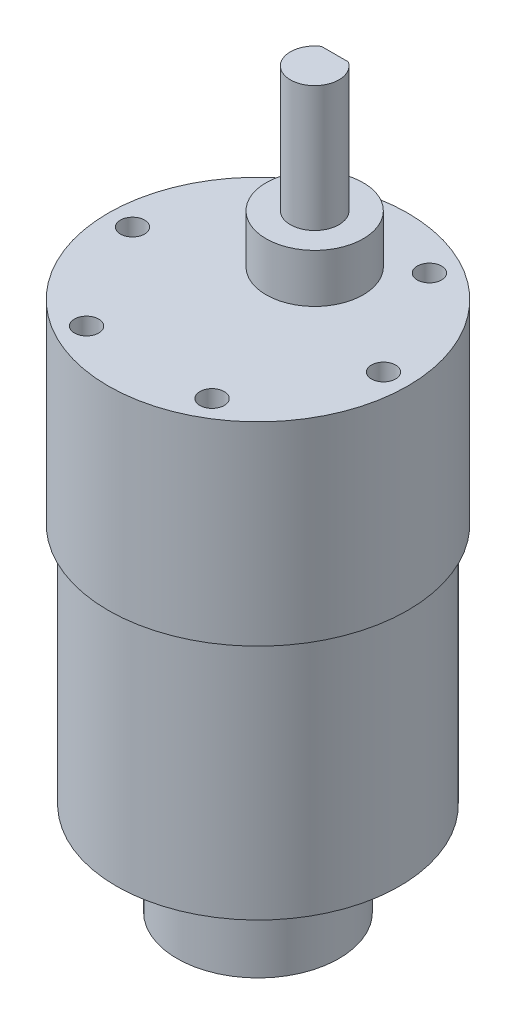
from build123d import *

# Parameters (mm, degrees)
SKETCH_1_R          = 18.5
EXTRUDE_1_DEPTH     = 24
SKETCH_2_R          = 6
EXTRUDE_2_DEPTH     = 6
SKETCH_3_R          = 3
EXTRUDE_3_DEPTH     = 15.5
SKETCH_4_R          = 17.5
EXTRUDE_4_DEPTH     = 30
SKETCH_5_R          = 10
EXTRUDE_6_DEPTH     = 11.5
CUT_EXTRUDE_1_DEPTH = 12
SKETCH_7_R          = 1.5
CUT_EXTRUDE_2_DEPTH = 10


with BuildPart() as part:
    # 草图1 → 凸台-拉伸1 (new body)
    with BuildSketch(Plane(origin=(0, 0, 0), x_dir=(1, 0, 0), z_dir=(0, 1, 0))):
        with Locations(Location((0, 0, 0), (0, 0, 270))):
            Circle(SKETCH_1_R)
    extrude(amount=EXTRUDE_1_DEPTH)

    # 草图2 → 凸台-拉伸2 (add)
    with BuildSketch(Plane(origin=(0, 24, 0), x_dir=(1, 0, 0), z_dir=(0, 1, 0))):
        with Locations(Location((0, 7, 0), (0, 0, 270))):
            Circle(SKETCH_2_R)
    extrude(amount=EXTRUDE_2_DEPTH)

    # 草图3 → 凸台-拉伸3 (add)
    with BuildSketch(Plane(origin=(0, 30, 0), x_dir=(1, 0, 0), z_dir=(0, 1, 0))):
        with Locations(Location((0, 7, 0), (0, 0, 270))):
            Circle(SKETCH_3_R)
    extrude(amount=EXTRUDE_3_DEPTH)

    # 草图4 → 凸台-拉伸4 (add)
    with BuildSketch(Plane.XZ):
        with Locations(Location((0, 0, 0), (0, 0, 90))):
            Circle(SKETCH_4_R)
    extrude(amount=EXTRUDE_4_DEPTH)

    # 草图5 → 凸台-拉伸6 (add)
    with BuildSketch(Plane.XZ.offset(30)):
        with Locations(Location((0, 0, 0), (0, 0, 270))):
            Circle(SKETCH_5_R)
    extrude(amount=EXTRUDE_6_DEPTH)

    # 草图6 → 切除-拉伸1 (cut)
    with BuildSketch(Plane(origin=(0, 45.5, 0), x_dir=(1, 0, 0), z_dir=(0, 1, 0))):
        with BuildLine():
            Line((-3.711279789, 9.5), (4.099560016, 9.5))
            ThreePointArc((4.099560016, 9.5), (0.194140114, 13.405419903), (-3.711279789, 9.5))
        make_face()
    extrude(amount=-CUT_EXTRUDE_1_DEPTH, mode=Mode.SUBTRACT)

    # 草图7 → 切除-拉伸2 (cut)
    with BuildSketch(Plane(origin=(0, 24, 0), x_dir=(1, 0, 0), z_dir=(0, 1, 0))):
        with Locations(Location((-15.5, 0, 0), (0, 0, 270))):
            Circle(SKETCH_7_R)
        with Locations(Location((-7.75, 13.423393759, 0), (0, 0, 270))):
            Circle(SKETCH_7_R)
        with Locations(Location((7.75, 13.423393759, 0), (0, 0, 270))):
            Circle(SKETCH_7_R)
        with Locations(Location((15.5, 0, 0), (0, 0, 270))):
            Circle(SKETCH_7_R)
        with Locations(Location((7.75, -13.423393759, 0), (0, 0, 270))):
            Circle(SKETCH_7_R)
        with Locations(Location((-7.75, -13.423393759, 0), (0, 0, 270))):
            Circle(SKETCH_7_R)
    extrude(amount=-CUT_EXTRUDE_2_DEPTH, mode=Mode.SUBTRACT)


solid = part.part
